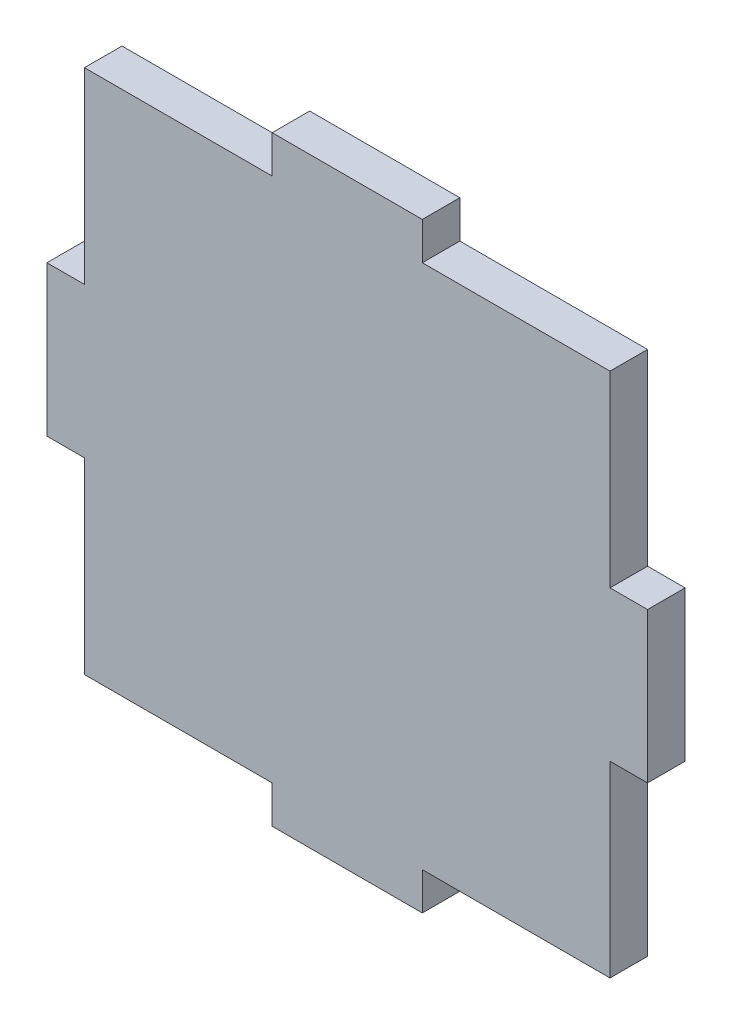
from build123d import *

# Parameters (mm, degrees)
BOSS_EXTRUDE1_DEPTH = 6.35


with BuildPart() as part:
    # Sketch5 → Boss-Extrude1 (new body)
    with BuildSketch(Plane.XY):
        Polygon((177.062770275, -302.628401611), (145.312770275, -302.628401611), (145.312770275, -334.378401611), (138.962770275, -334.378401611), (138.962770275, -359.778401611), (145.312770275, -359.778401611), (145.312770275, -391.528401611), (177.062770275, -391.528401611), (177.062770275, -397.878401611), (202.462770275, -397.878401611), (202.462770275, -391.528401611), (234.212770275, -391.528401611), (234.212770275, -359.778401611), (240.562770275, -359.778401611), (240.562770275, -334.378401611), (234.212770275, -334.378401611), (234.212770275, -302.628401611), (202.462770275, -302.628401611), (202.462770275, -296.278401611), (177.062770275, -296.278401611), align=None)
    extrude(amount=BOSS_EXTRUDE1_DEPTH)


solid = part.part
